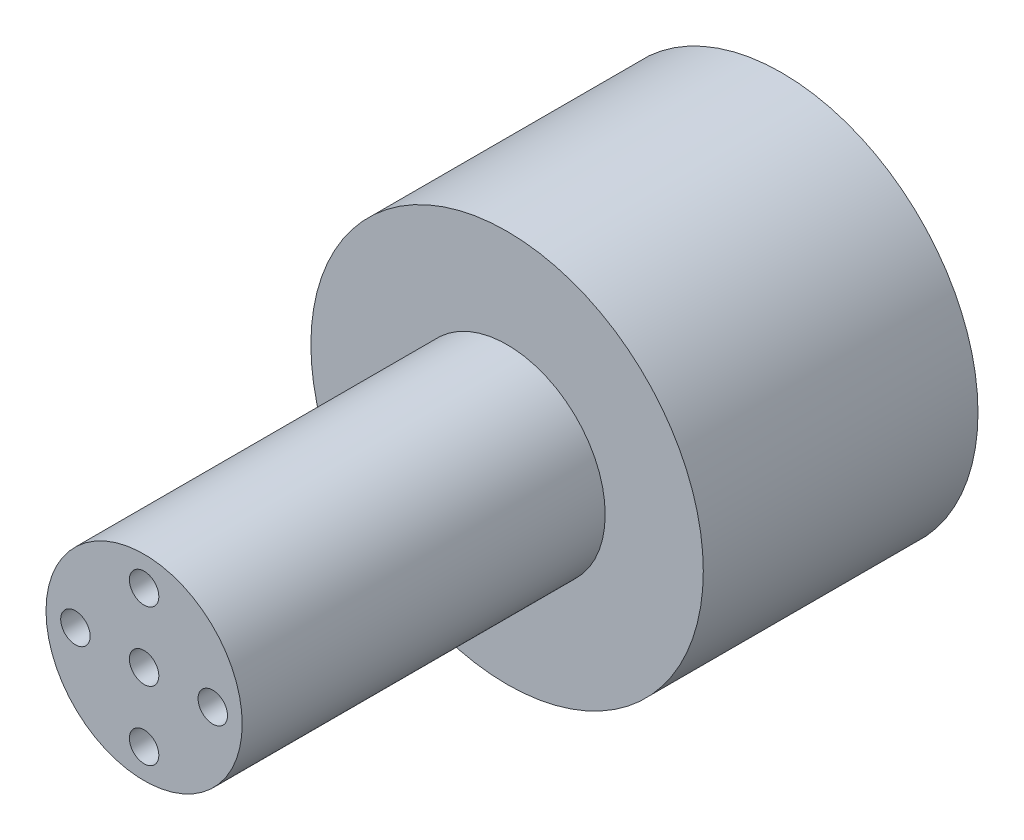
from build123d import *

# Parameters (mm, degrees)
SKETCH_1_R          = 10
EXTRUDE_1_DEPTH     = 65
CUT_EXTRUDE_1_DEPTH = 2.5
SKETCH_3_R          = 20
EXTRUDE_2_DEPTH     = 28
SKETCH_4_R          = 1.5
CUT_EXTRUDE_2_DEPTH = 10
SKETCH_5_R          = 1.5
CUT_EXTRUDE_3_DEPTH = 10


with BuildPart() as part:
    # 草图1 → 凸台-拉伸1 (new body)
    with BuildSketch(Plane.XY):
        Circle(SKETCH_1_R)
    extrude(amount=EXTRUDE_1_DEPTH)

    # 草图2 → 切除-拉伸1 (cut)
    with BuildSketch(Plane.ZY.offset(10)):
        with BuildLine():
            Line((30.5, 2.5), (35.55, 2.5))
            ThreePointArc((35.55, 2.5), (38.05, 0), (35.55, -2.5))
            Line((35.55, -2.5), (30.5, -2.5))
            ThreePointArc((30.5, -2.5), (28, 0), (30.5, 2.5))
        make_face()
    extrude(amount=-CUT_EXTRUDE_1_DEPTH, mode=Mode.SUBTRACT)

    # 草图3 → 凸台-拉伸2 (add)
    with BuildSketch(Plane(origin=(0, 0, 0), x_dir=(-1, 0, 0), z_dir=(0, 0, -1))):
        Circle(SKETCH_3_R)
    extrude(amount=-EXTRUDE_2_DEPTH)

    # 草图4 → 切除-拉伸2 (cut)
    with BuildSketch(Plane.XY.offset(65)):
        with Locations((0, 7)):
            Circle(SKETCH_4_R)
        with Locations((7, 0)):
            Circle(SKETCH_4_R)
        with Locations((0, -7)):
            Circle(SKETCH_4_R)
        with Locations((-7, 0)):
            Circle(SKETCH_4_R)
    extrude(amount=-CUT_EXTRUDE_2_DEPTH, mode=Mode.SUBTRACT)

    # 草图5 → 切除-拉伸3 (cut)
    with BuildSketch(Plane.XY.offset(65)):
        Circle(SKETCH_5_R)
    extrude(amount=-CUT_EXTRUDE_3_DEPTH, mode=Mode.SUBTRACT)


solid = part.part
